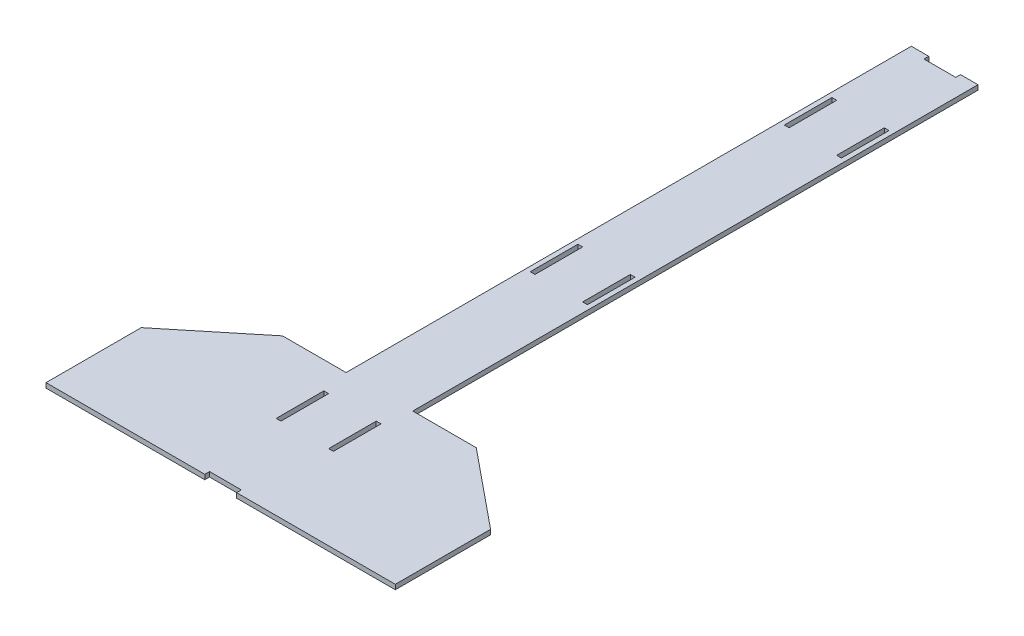
from build123d import *

# Parameters (mm, degrees)
SKETCH1_W           = 3
SKETCH1_H           = 30
BOSS_EXTRUDE1_DEPTH = 3


with BuildPart() as part:
    # Sketch1 → Boss-Extrude1 (new body)
    with BuildSketch(Plane(origin=(0, 0, 0), x_dir=(1, 0, 0), z_dir=(0, 1, 0))):
        Polygon((31, 456), (42, 456), (42, 100), (82, 100), (131, 60), (131, 0), (31, 0), (31, 3), (11, 3), (11, 0), (-89, 0), (-89, 60), (-40, 100), (0, 100), (0, 456), (11, 456), (11, 453), (31, 453), align=None)
        with Locations((37.5, 68)):
            Rectangle(SKETCH1_W, SKETCH1_H, mode=Mode.SUBTRACT)
        with Locations((37.5, 228)):
            Rectangle(SKETCH1_W, SKETCH1_H, mode=Mode.SUBTRACT)
        with Locations((37.5, 388)):
            Rectangle(SKETCH1_W, SKETCH1_H, mode=Mode.SUBTRACT)
        with Locations((4.5, 68)):
            Rectangle(SKETCH1_W, SKETCH1_H, mode=Mode.SUBTRACT)
        with Locations((4.5, 228)):
            Rectangle(SKETCH1_W, SKETCH1_H, mode=Mode.SUBTRACT)
        with Locations((4.5, 388)):
            Rectangle(SKETCH1_W, SKETCH1_H, mode=Mode.SUBTRACT)
    extrude(amount=BOSS_EXTRUDE1_DEPTH)


solid = part.part
